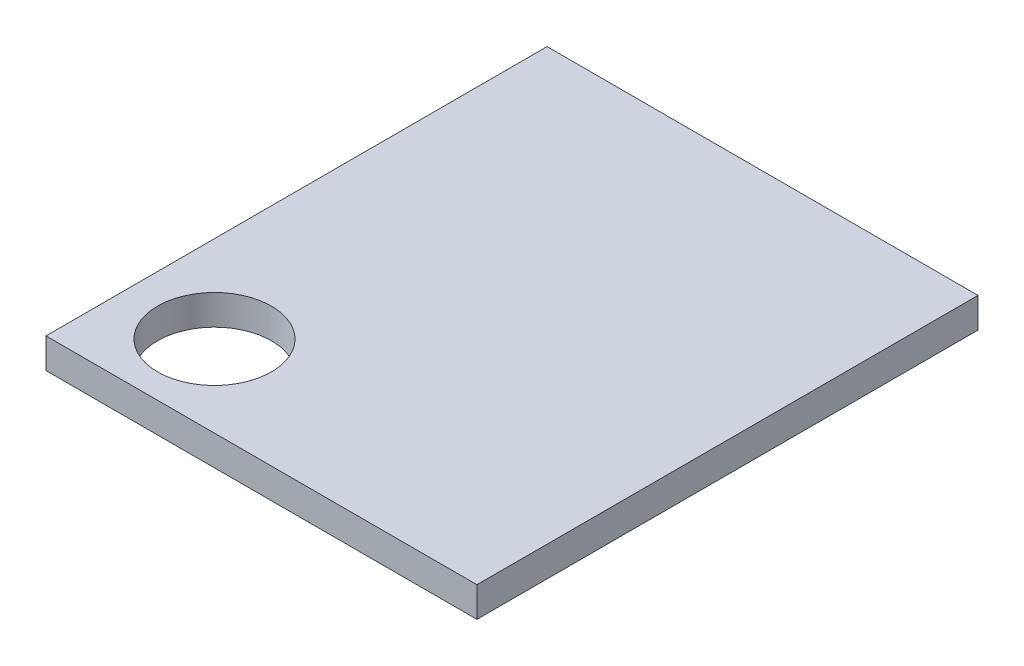
from build123d import *

# Parameters (mm, degrees)
ESQUISSE3_W             = 215
ESQUISSE3_H             = 15
BOSS_EXTRU_2_DEPTH      = 250
ESQUISSE4_R             = 28.429866642
ENL_V_MAT_EXTRU_1_DEPTH = 250


with BuildPart() as part:
    # Esquisse3 → Boss.-Extru.2 (new body)
    with BuildSketch(Plane.XY):
        with Locations((107.5, 7.5)):
            Rectangle(ESQUISSE3_W, ESQUISSE3_H)
    extrude(amount=BOSS_EXTRU_2_DEPTH)

    # Esquisse4 → Enlèv. mat.-Extru.1 (cut)
    with BuildSketch(Plane(origin=(0, 15, 0), x_dir=(1, 0, 0), z_dir=(0, 1, 0))):
        with Locations(Location((43.362759914, -209.297264429, 0), (0, 0, 270))):
            Circle(ESQUISSE4_R)
    extrude(amount=-ENL_V_MAT_EXTRU_1_DEPTH, mode=Mode.SUBTRACT)


solid = part.part
